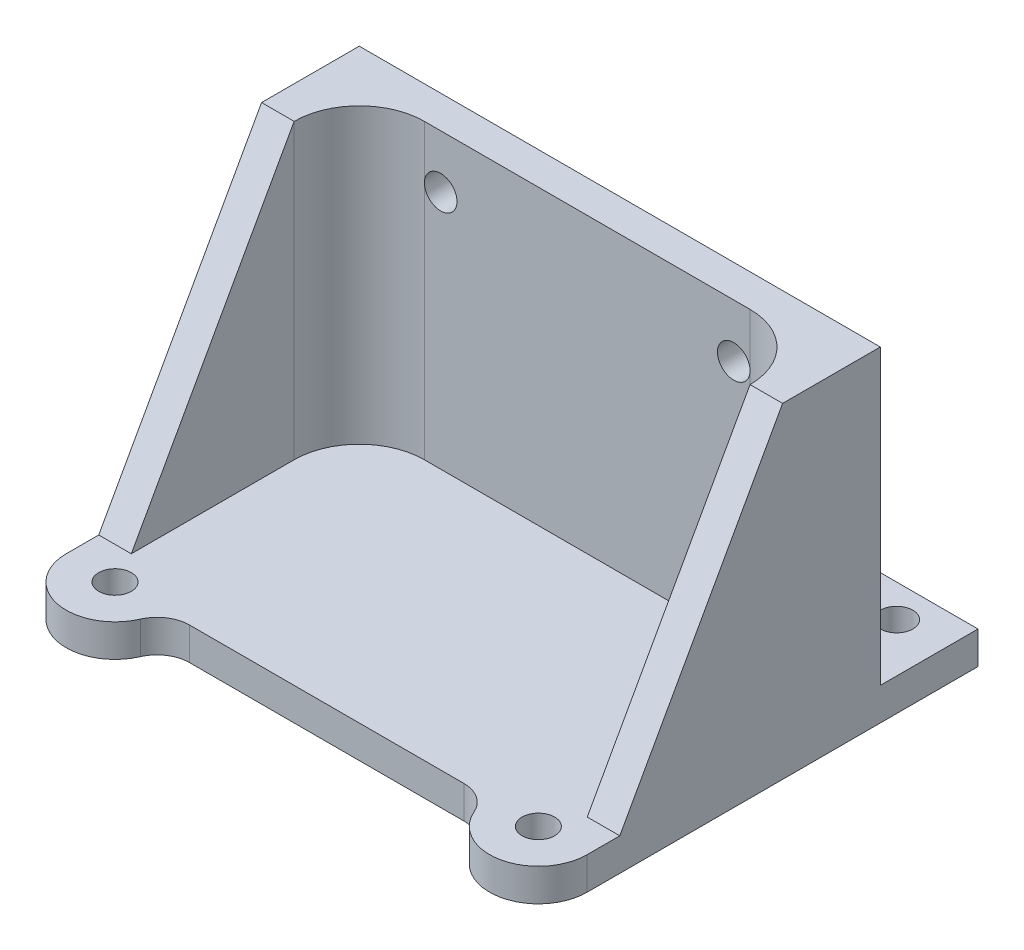
from build123d import *

# Parameters (mm, degrees)
SKETCH1_R             = 2.5
BOSS_EXTRUDE1_DEPTH   = 5
SKETCH1_W             = 80
SKETCH1_H             = 15
BOSS_EXTRUDE1_2_DEPTH = 5
BOSS_EXTRUDE2_DEPTH   = 50
CUT_EXTRUDE1_DEPTH    = 40
FILLET1_R             = 10
SKETCH3_R             = 2.5
CUT_EXTRUDE2_DEPTH    = 20
FILLET2_R             = 5


with BuildPart() as part:
    # Sketch1 → Boss-Extrude1 (new body)
    with BuildSketch(Plane(origin=(0, 0, 0), x_dir=(1, 0, 0), z_dir=(0, 1, 0))):
        with BuildLine():
            ThreePointArc((-40, -30), (-32.5, -37.5), (-25, -30))
            Line((-25, -30), (25, -30))
            ThreePointArc((25, -30), (32.5, -37.5), (40, -30))
            Line((40, -30), (40, -25))
            Line((40, -25), (35, -25))
            Line((35, -25), (35, 10))
            Line((35, 10), (-35, 10))
            Line((-35, 10), (-35, -25))
            Line((-35, -25), (-40, -25))
            Line((-40, -25), (-40, -30))
        make_face()
        with Locations((-32.5, -30)):
            Circle(SKETCH1_R, mode=Mode.SUBTRACT)
        with Locations((32.5, -30)):
            Circle(SKETCH1_R, mode=Mode.SUBTRACT)
    extrude(amount=BOSS_EXTRUDE1_DEPTH)



with BuildPart() as body_2:
    # Sketch1 → Boss-Extrude1 2 (new body)
    with BuildSketch(Plane(origin=(0, 0, 0), x_dir=(1, 0, 0), z_dir=(0, 1, 0))):
        with Locations((0, 22.5)):
            Rectangle(SKETCH1_W, SKETCH1_H)
        with Locations((-32.5, 25)):
            Circle(SKETCH1_R, mode=Mode.SUBTRACT)
        with Locations((32.5, 25)):
            Circle(SKETCH1_R, mode=Mode.SUBTRACT)
    extrude(amount=BOSS_EXTRUDE1_2_DEPTH)


with BuildPart() as part_1:
    add(part.part)

    add(body_2.part)  # Boss-Extrude2 merges body 2
    # Sketch1<3> → Boss-Extrude2 (add)
    with BuildSketch(Plane(origin=(0, 0, 0), x_dir=(1, 0, 0), z_dir=(0, 1, 0))):
        Polygon((-40, -25), (-35, -25), (-35, 10), (35, 10), (35, -25), (40, -25), (40, 15), (-40, 15), align=None)
    extrude(amount=BOSS_EXTRUDE2_DEPTH)

    # Sketch2 → Cut-Extrude1 (cut, symmetric)
    with BuildSketch(Plane(origin=(0, 0, 0), x_dir=(0, 0, -1), z_dir=(1, 0, 0))):
        Polygon((0, 50), (-25, 5), (-25, 50), align=None)
    extrude(amount=CUT_EXTRUDE1_DEPTH, both=True, mode=Mode.SUBTRACT)

    # Fillet1
    fillet1_edges = [part_1.edges().sort_by_distance(p)[0] for p in [
        (-35, 27.5, -10),
        (35, 27.5, -10),
    ]]
    fillet(fillet1_edges, radius=FILLET1_R)

    # Sketch3 → Cut-Extrude2 (cut)
    with BuildSketch(Plane.XY):
        with Locations((-22.5, 41.833761029)):
            Circle(SKETCH3_R)
        with Locations((22.5, 41.833761029)):
            Circle(SKETCH3_R)
    extrude(amount=-CUT_EXTRUDE2_DEPTH, mode=Mode.SUBTRACT)

    # Fillet2
    fillet2_edges = [part_1.edges().sort_by_distance(p)[0] for p in [
        (25, 2.5, 30),
        (-25, 2.5, 30),
    ]]
    fillet(fillet2_edges, radius=FILLET2_R)


solid = part_1.part
